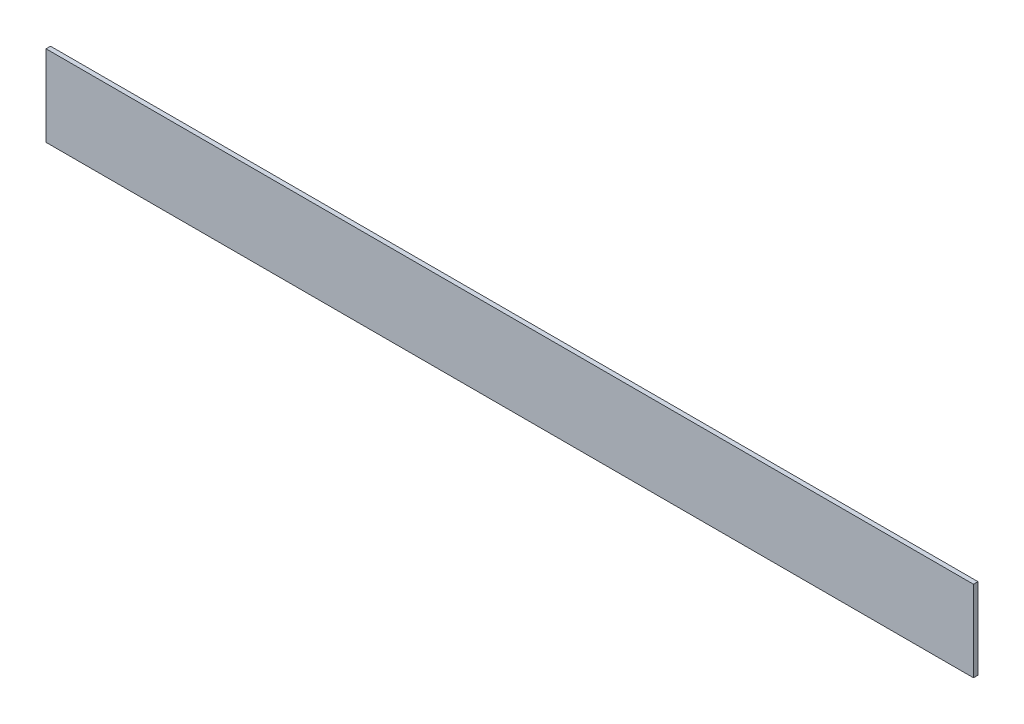
from build123d import *

# Parameters (mm, degrees)
SKETCH1_W           = 654.05
SKETCH1_H           = 57.15
BOSS_EXTRUDE1_DEPTH = 3.175


with BuildPart() as part:
    # Sketch1 → Boss-Extrude1 (new body)
    with BuildSketch(Plane.XY):
        with Locations((0, 28.575)):
            Rectangle(SKETCH1_W, SKETCH1_H)
    extrude(amount=BOSS_EXTRUDE1_DEPTH)


solid = part.part
